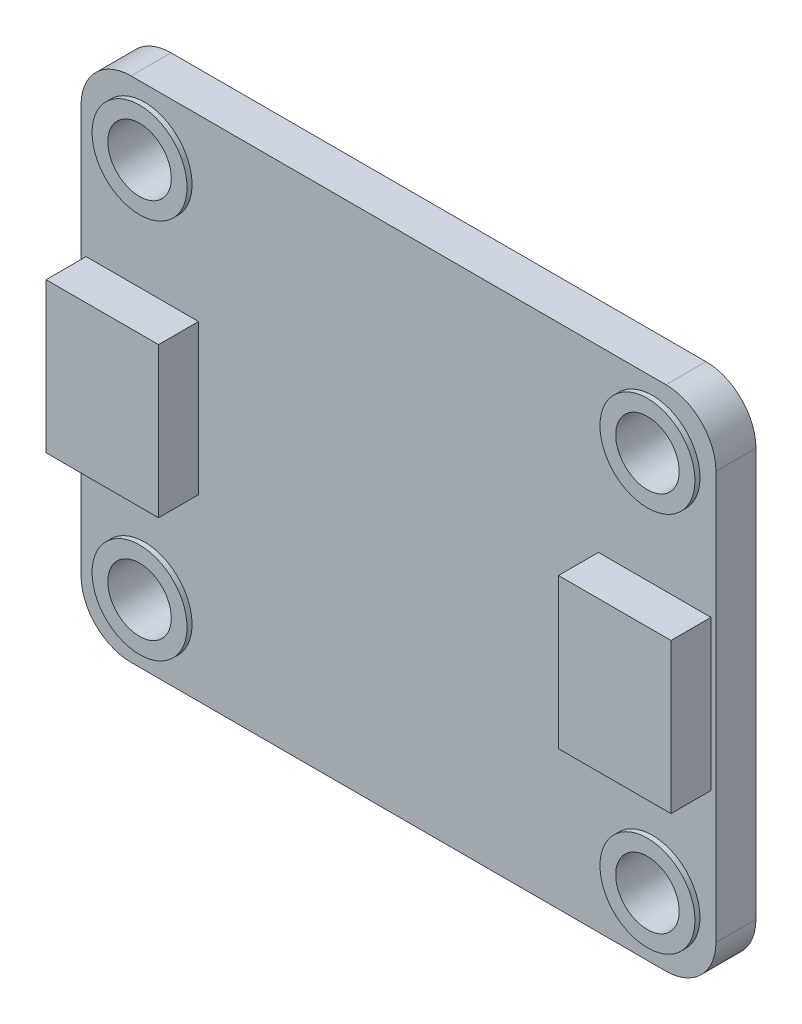
from build123d import *

# Parameters (mm, degrees)
SKETCH1_W           = 25.4
SKETCH1_H           = 20.32
BOSS_EXTRUDE1_DEPTH = 1.6
FILLET1_R           = 2
SKETCH2_R           = 1.27
CUT_EXTRUDE1_DEPTH  = 33.567198222
BOSS_EXTRUDE4_START = -0.2
SKETCH5_R           = 1.9
SKETCH5_R_2         = 1.27
BOSS_EXTRUDE4_DEPTH = 2
BOSS_EXTRUDE3_START = 1.6
SKETCH4_W           = 4.5
SKETCH4_H           = 6
BOSS_EXTRUDE3_DEPTH = 1.6


with BuildPart() as part:
    # Sketch1 → Boss-Extrude1 (new body)
    with BuildSketch(Plane.XY):
        with Locations((12.7, 10.16)):
            Rectangle(SKETCH1_W, SKETCH1_H)
    extrude(amount=BOSS_EXTRUDE1_DEPTH)

    # Fillet1
    fillet1_edges = [part.edges().sort_by_distance(p)[0] for p in [
        (0, 20.32, 0.8),
        (25.4, 20.32, 0.8),
        (25.4, 0, 0.8),
        (0, 0, 0.8),
    ]]
    fillet(fillet1_edges, radius=FILLET1_R)

    # Sketch2 → Cut-Extrude1 (cut, through all)
    with BuildSketch(Plane.XY):
        with Locations((2.54, 17.78)):
            Circle(SKETCH2_R)
        with Locations((22.86, 17.78)):
            Circle(SKETCH2_R)
        with Locations((22.86, 2.54)):
            Circle(SKETCH2_R)
        with Locations((2.54, 2.54)):
            Circle(SKETCH2_R)
    extrude(amount=CUT_EXTRUDE1_DEPTH, mode=Mode.SUBTRACT)

    # Sketch5 → Boss-Extrude4 (add)
    # profile 1 of 4: a face of its own
    with BuildSketch(Plane.XY.offset(BOSS_EXTRUDE4_START)):
        with Locations(Location((2.54, 17.78, 0), (0, 0, 180))):
            Circle(SKETCH5_R)
        with Locations((2.54, 17.78)):
            Circle(SKETCH5_R_2, mode=Mode.SUBTRACT)
    # profile 2 of 4: a face of its own
    with BuildSketch(Plane.XY.offset(BOSS_EXTRUDE4_START)):
        with Locations(Location((22.86, 17.78, 0), (0, 0, 180))):
            Circle(SKETCH5_R)
        with Locations((22.86, 17.78)):
            Circle(SKETCH5_R_2, mode=Mode.SUBTRACT)
    # profile 3 of 4: a face of its own
    with BuildSketch(Plane.XY.offset(BOSS_EXTRUDE4_START)):
        with Locations(Location((22.86, 2.54, 0), (0, 0, 180))):
            Circle(SKETCH5_R)
        with Locations((22.86, 2.54)):
            Circle(SKETCH5_R_2, mode=Mode.SUBTRACT)
    # profile 4 of 4: a face of its own
    with BuildSketch(Plane.XY.offset(BOSS_EXTRUDE4_START)):
        with Locations(Location((2.54, 2.54, 0), (0, 0, 180))):
            Circle(SKETCH5_R)
        with Locations((2.54, 2.54)):
            Circle(SKETCH5_R_2, mode=Mode.SUBTRACT)
    extrude(amount=BOSS_EXTRUDE4_DEPTH)

    # Sketch4 → Boss-Extrude3 (add)
    with BuildSketch(Plane.XY.offset(BOSS_EXTRUDE3_START)):
        with Locations((2.45, 10.16)):
            Rectangle(SKETCH4_W, SKETCH4_H)
        with Locations((22.95, 10.16)):
            Rectangle(SKETCH4_W, SKETCH4_H)
    extrude(amount=BOSS_EXTRUDE3_DEPTH)


solid = part.part
